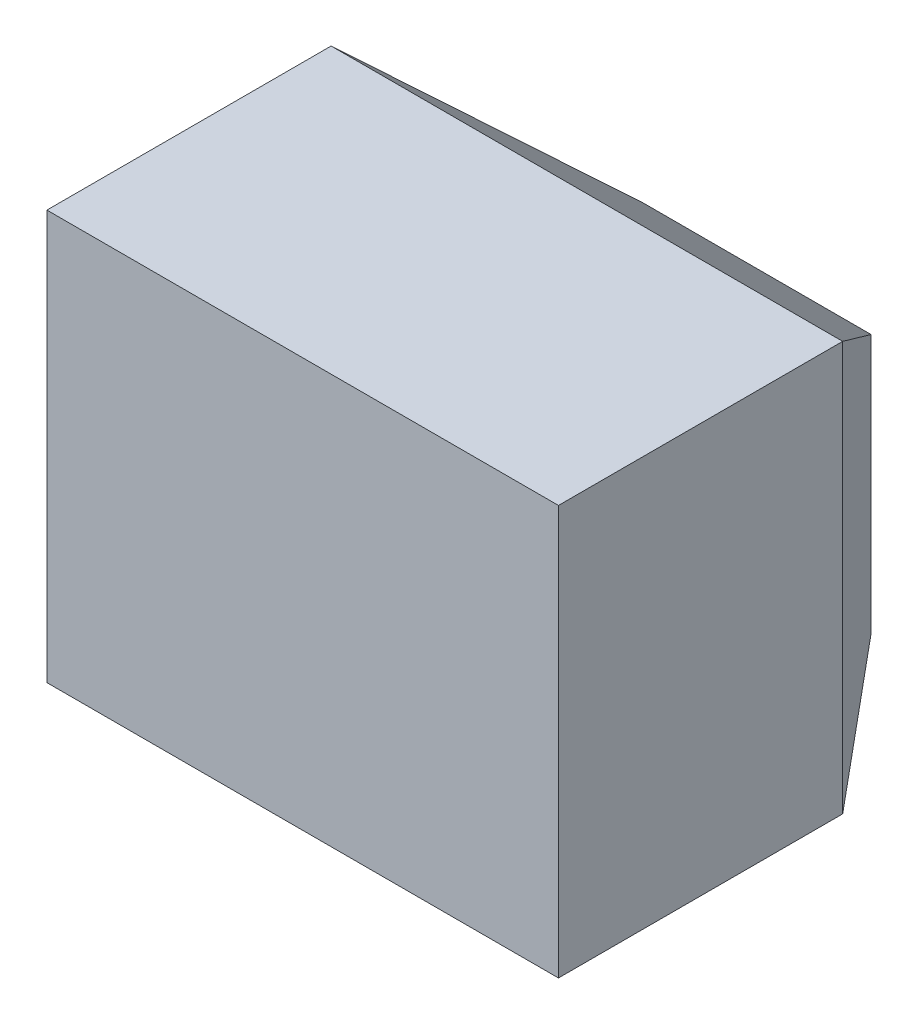
from build123d import *

# Parameters (mm, degrees)
EXTRUDE_1_DEPTH     = 360
CUT_EXTRUDE_1_DEPTH = 702.498396292


with BuildPart() as part:
    # 草图1 → 凸台-拉伸1 (new body)
    with BuildSketch(Plane(origin=(0, 0, 0), x_dir=(1, 0, 0), z_dir=(0, 1, 0))):
        Polygon((-225, 0), (225, 0), (225, 250), (100, 400), (-100, 400), (-225, 250), align=None)
    extrude(amount=EXTRUDE_1_DEPTH)

    # 草图2 → 切除-拉伸1 (cut, through all)
    with BuildSketch(Plane(origin=(225, 0, 0), x_dir=(0, 0, -1), z_dir=(1, 0, 0))):
        Polygon((250, 360), (400, 227.712434447), (400, 360), align=None)
    extrude(amount=-CUT_EXTRUDE_1_DEPTH, mode=Mode.SUBTRACT)


solid = part.part
